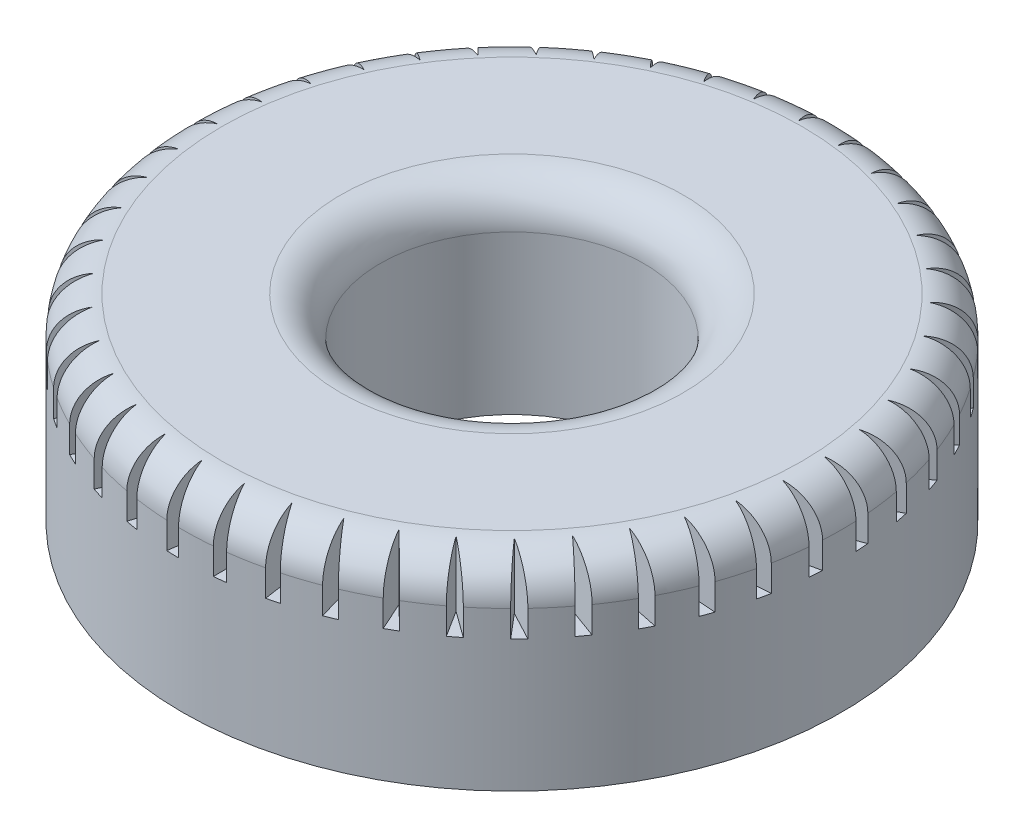
from build123d import *

# Parameters (mm, degrees)
SKETCH1_R           = 25
SKETCH1_R_2         = 10
BOSS_EXTRUDE2_DEPTH = 15
FILLET3_R           = 3
CUT_EXTRUDE3_DEPTH  = 5


with BuildPart() as part:
    # Sketch1 → Boss-Extrude2 (new body)
    with BuildSketch(Plane(origin=(0, 0, 0), x_dir=(1, 0, 0), z_dir=(0, 1, 0))):
        with Locations(Location((-47.903603978, 46.290270165, 0), (0, 0, 270))):
            Circle(SKETCH1_R)
        with Locations(Location((-47.903603978, 46.290270165, 0), (0, 0, 270))):
            Circle(SKETCH1_R_2, mode=Mode.SUBTRACT)
    extrude(amount=BOSS_EXTRUDE2_DEPTH)

    # Fillet3
    fillet3_edges = [part.edges().sort_by_distance(p)[0] for p in [
        (-47.903603978, 15, -71.290270165),
        (-47.903603978, 15, -56.290270165),
    ]]
    fillet(fillet3_edges, radius=FILLET3_R)

    # Sketch4 → Cut-Extrude3 (cut)
    with BuildSketch(Plane(origin=(0, 15, 0), x_dir=(1, 0, 0), z_dir=(0, 1, 0))):
        Polygon((-49.472279357, 71.777906718), (-48.419795425, 68.545277496), (-48.216076725, 71.723289212), align=None)
        Polygon((-45.884349233, 71.756720493), (-45.292003035, 68.409073544), (-44.647973166, 71.527804905), align=None)
        Polygon((-42.334285151, 71.236397089), (-42.213606032, 67.838890553), (-41.141800303, 70.837639001), align=None)
        Polygon((-38.891185069, 70.22706401), (-39.244521911, 66.845826487), (-37.765801802, 69.666224794), align=None)
        Polygon((-35.622065016, 68.748366776), (-36.442540519, 65.449210209), (-34.585687634, 68.03636253), align=None)
        Polygon((-32.590554694, 66.829086547), (-33.862199236, 63.676225264), (-31.663355104, 65.979775623), align=None)
        Polygon((-29.855659002, 64.506579929), (-31.553721469, 61.56138079), (-29.05568409, 63.536493198), align=None)
        Polygon((-27.470609576, 61.826051871), (-29.562039113, 59.145839827), (-26.813429943, 60.754070969), align=None)
        Polygon((-25.481828689, 58.839675804), (-27.925917998, 56.476618132), (-24.980235589, 57.686665618), align=None)
        Polygon((-23.928025699, 55.60557814), (-26.677203363, 53.605669071), (-23.591782072, 54.393980703), align=None)
        Polygon((-22.839443613, 52.186706911), (-25.840200016, 50.588872401), (-22.675094058, 50.940104589), align=None)
        Polygon((-22.237270444, 48.649606558), (-25.431199275, 47.484946638), (-22.248013838, 47.392263047), align=None)
        Polygon((-22.133226807, 45.063122715), (-25.458161875, 44.354306165), (-22.318854043, 43.819510776), align=None)
        Polygon((-22.529337794, 41.497062211), (-25.92056302, 41.257885338), (-22.886235848, 40.291387336), align=None)
        Polygon((-23.417893554, 38.020834357), (-26.809402597, 38.255952468), (-23.939115812, 36.876563636), align=None)
        Polygon((-24.781599361, 34.702099974), (-28.107380354, 35.406936762), (-25.457000825, 33.641505335), align=None)
        Polygon((-26.593912232, 31.605454452), (-29.789232632, 32.76629107), (-27.41034698, 30.649179163), align=None)
        Polygon((-28.819557559, 28.791170473), (-31.822224088, 30.385412558), (-29.761134617, 27.957827345), align=None)
        Polygon((-31.415215687, 26.314024874), (-34.166784857, 28.310642317), (-32.463608329, 25.619833983), align=None)
        Polygon((-34.330365083, 24.222232477), (-36.77728073, 26.58236339), (-35.465167539, 23.680705459), align=None)
        Polygon((-37.50826568, 22.55650764), (-39.602901374, 25.23421476), (-38.707390311, 22.178184703), align=None)
        Polygon((-40.887063257, 21.349271804), (-42.588649298, 24.292436607), (-42.127170466, 21.141516573), align=None)
        Polygon((-44.400993364, 20.624022441), (-45.676410314, 23.775359572), (-45.657945874, 20.590878635), align=None)
        Polygon((-47.981661347, 20.394875704), (-48.806084666, 23.69304797), (-49.230994008, 20.53698843), align=None)
        Polygon((-51.559373578, 20.666291673), (-51.916756804, 24.047103904), (-52.77676955, 20.980894869), align=None)
        Polygon((-55.064493957, 21.432987547), (-54.947881032, 24.830636078), (-56.226258013, 21.913957819), align=None)
        Polygon((-58.428799303, 22.680040462), (-57.840459965, 26.028393928), (-59.512319027, 23.31801627), align=None)
        Polygon((-61.586807239, 24.383177951), (-60.538192845, 27.617064461), (-62.570993153, 25.165741822), align=None)
        Polygon((-64.477050734, 26.50925038), (-62.988571369, 29.565726012), (-65.342746777, 27.421170599), align=None)
        Polygon((-67.043274485, 29.016876169), (-65.143901707, 31.836450101), (-67.773630869, 30.040403246), align=None)
        Polygon((-69.235529865, 31.857247232), (-66.962232805, 34.385039666), (-69.816331034, 32.972459377), align=None)
        Polygon((-71.011147119, 34.975078979), (-68.408172917, 37.161889309), (-71.431088438, 36.160269856), align=None)
        Polygon((-72.335565874, 38.309686362), (-69.453578464, 40.112950812), (-72.586473664, 39.541787578), align=None)
        Polygon((-73.183007828, 41.796165039), (-70.078101816, 43.180785119), (-73.259998453, 43.051195146), align=None)
        Polygon((-73.536978485, 45.366654671), (-70.269587335, 46.305680325), (-73.438553411, 46.620185935), align=None)
        Polygon((-73.390588211, 48.951659736), (-70.024307974, 49.4268139), (-73.11866317, 50.179293597), align=None)
        Polygon((-72.746686325, 52.481402191), (-69.347037817, 52.483436527), (-72.306554028, 53.659244152), align=None)
        Polygon((-71.617805644, 55.887179612), (-68.250959158, 55.416054525), (-71.018032767, 56.99230432), align=None)
        Polygon((-70.025918548, 59.102702416), (-66.75740592, 58.167587821), (-69.278178986, 60.113599876), align=None)
        Polygon((-68.002009308, 62.065384111), (-64.895448418, 60.684480948), (-67.120856962, 62.962378352), align=None)
        Polygon((-65.585471015, 64.717559465), (-62.701327537, 62.917745445), (-64.588056513, 65.483191516), align=None)
        Polygon((-62.823338838, 67.007606904), (-60.217749344, 64.823913358), (-61.729075719, 67.626974607), align=None)
        Polygon((-59.769374538, 68.890953258), (-57.493053864, 66.365883298), (-58.599561388, 69.352001325), align=None)
        Polygon((-56.483020056, 70.330941332), (-54.580274196, 67.513642573), (-55.260425959, 70.624695988), align=None)
        Polygon((-53.028240545, 71.299543398), (-51.536104281, 68.244851355), (-51.776661903, 71.420287042), align=None)
    extrude(amount=-CUT_EXTRUDE3_DEPTH, mode=Mode.SUBTRACT)


solid = part.part
